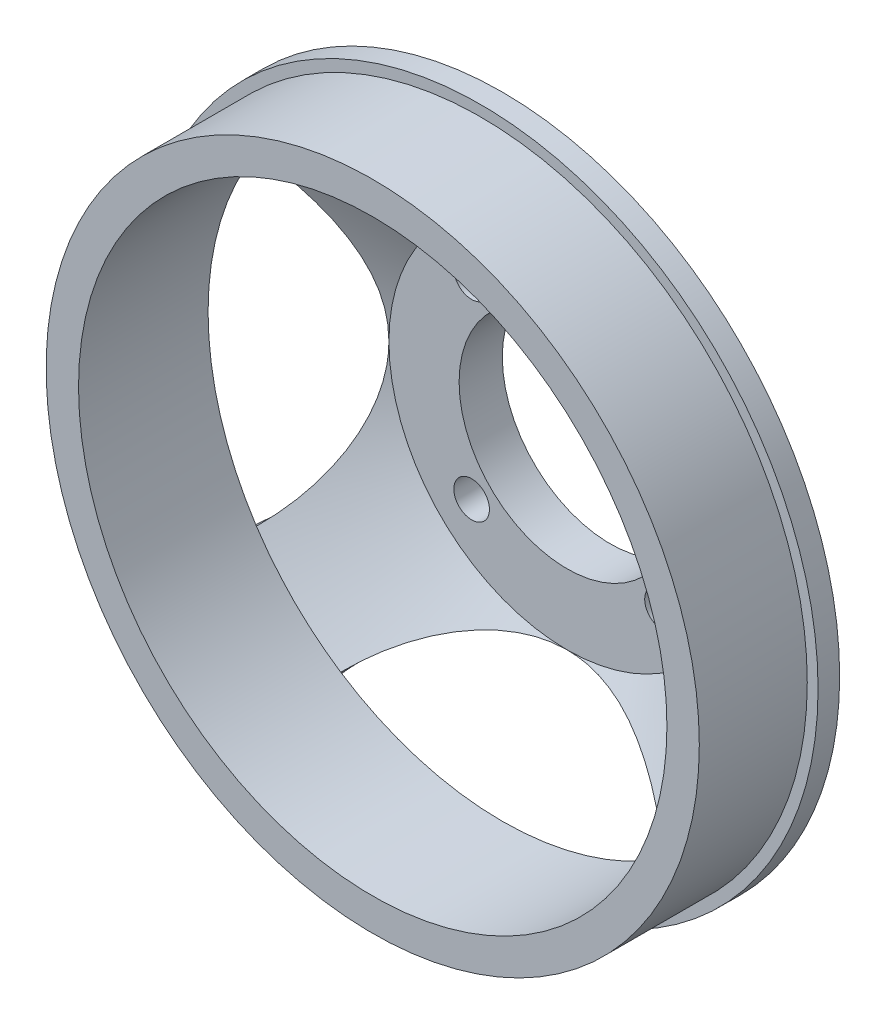
from build123d import *

# Parameters (mm, degrees)
SKETCH1_R             = 31.25
SKETCH1_R_2           = 27.25
BOSS_EXTRUDE2_DEPTH   = 12
SKETCH7_R             = 16.5
SKETCH7_R_2           = 10
BOSS_EXTRUDE6_DEPTH   = 4
SKETCH7_16_OUTSIDE_W  = 82.718
SKETCH7_16_OUTSIDE_H  = 82.718
CUT_EXTRUDE3_DEPTH    = 10
M4X0_7_TAPPED_HOLE1_D = 3.3
CUT_EXTRUDE4_START    = -10
SKETCH20_R            = 31.25
SKETCH20_R_2          = 30.25
CUT_EXTRUDE4_DEPTH    = 10


with BuildPart() as part:
    # Sketch1 → Boss-Extrude2 (new body)
    with BuildSketch(Plane.XY):
        Circle(SKETCH1_R)
        Circle(SKETCH1_R_2, mode=Mode.SUBTRACT)
    extrude(amount=BOSS_EXTRUDE2_DEPTH)



with BuildPart() as body_2:
    # Sketch7 → Boss-Extrude6 (new body)
    with BuildSketch(Plane(origin=(0, 0, -10), x_dir=(-1, 0, 0), z_dir=(0, 0, -1))):
        Circle(SKETCH7_R)
        Circle(SKETCH7_R_2, mode=Mode.SUBTRACT)
    extrude(amount=-BOSS_EXTRUDE6_DEPTH)


with BuildPart() as part_1:
    add(part.part)

    add(body_2.part)  # Revolve1 merges body 2
    # Sketch10 → Revolve1 (revolve)
    with BuildSketch(Plane(origin=(0, 0, 0), x_dir=(1, 0, 0), z_dir=(0, 1, 0))):
        Polygon((-31.25, 0), (-27.25, 0), (-16.5, 6), (-16.5, 10), align=None)
    revolve(axis=Axis((0, 0, 0), (0, 0, -1)))

    # Sketch7<16> outside → Cut-Extrude3 (cut)
    with BuildSketch(Plane(origin=(0, 0, -10), x_dir=(-1, 0, 0), z_dir=(0, 0, -1))):
        Rectangle(SKETCH7_16_OUTSIDE_W, SKETCH7_16_OUTSIDE_H)
        with BuildLine():
            ThreePointArc((25.890833333, 17.499349968), (18.996047719, 9.929942094), (16.5, 0))
            ThreePointArc((16.5, 0), (18.996047719, -9.929942094), (25.890833333, -17.499349968))
            ThreePointArc((25.890833333, -17.499349968), (22.097086912, -22.097086912), (17.499349968, -25.890833333))
            ThreePointArc((17.499349968, -25.890833333), (9.929942094, -18.996047719), (0, -16.5))
            ThreePointArc((0, -16.5), (-9.929942094, -18.996047719), (-17.499349968, -25.890833333))
            ThreePointArc((-17.499349968, -25.890833333), (-22.097086912, -22.097086912), (-25.890833333, -17.499349968))
            ThreePointArc((-25.890833333, -17.499349968), (-18.996047719, -9.929942094), (-16.5, 0))
            ThreePointArc((-16.5, 0), (-18.996047719, 9.929942094), (-25.890833333, 17.499349968))
            ThreePointArc((-25.890833333, 17.499349968), (-22.097086912, 22.097086912), (-17.499349968, 25.890833333))
            ThreePointArc((-17.499349968, 25.890833333), (-9.929942094, 18.996047719), (0, 16.5))
            ThreePointArc((0, 16.5), (9.929942094, 18.996047719), (17.499349968, 25.890833333))
            ThreePointArc((17.499349968, 25.890833333), (22.097086912, 22.097086912), (25.890833333, 17.499349968))
        make_face(mode=Mode.SUBTRACT)
    extrude(amount=-CUT_EXTRUDE3_DEPTH, mode=Mode.SUBTRACT)

    # M4x0.7 Tapped Hole1 (through all)
    with Locations(Plane(origin=(0, 0, -10), x_dir=(-1, 0, 0), z_dir=(0, 0, -1))):
        with Locations((-8.838834765, 8.838834765), (8.838834765, 8.838834765), (8.838834765, -8.838834765), (-8.838834765, -8.838834765)):
            Hole(M4X0_7_TAPPED_HOLE1_D / 2)

    # Sketch20 → Cut-Extrude4 (cut)
    with BuildSketch(Plane.XY.offset(12).offset(CUT_EXTRUDE4_START)):
        Circle(SKETCH20_R)
        Circle(SKETCH20_R_2, mode=Mode.SUBTRACT)
    extrude(amount=CUT_EXTRUDE4_DEPTH, mode=Mode.SUBTRACT)


solid = part_1.part
